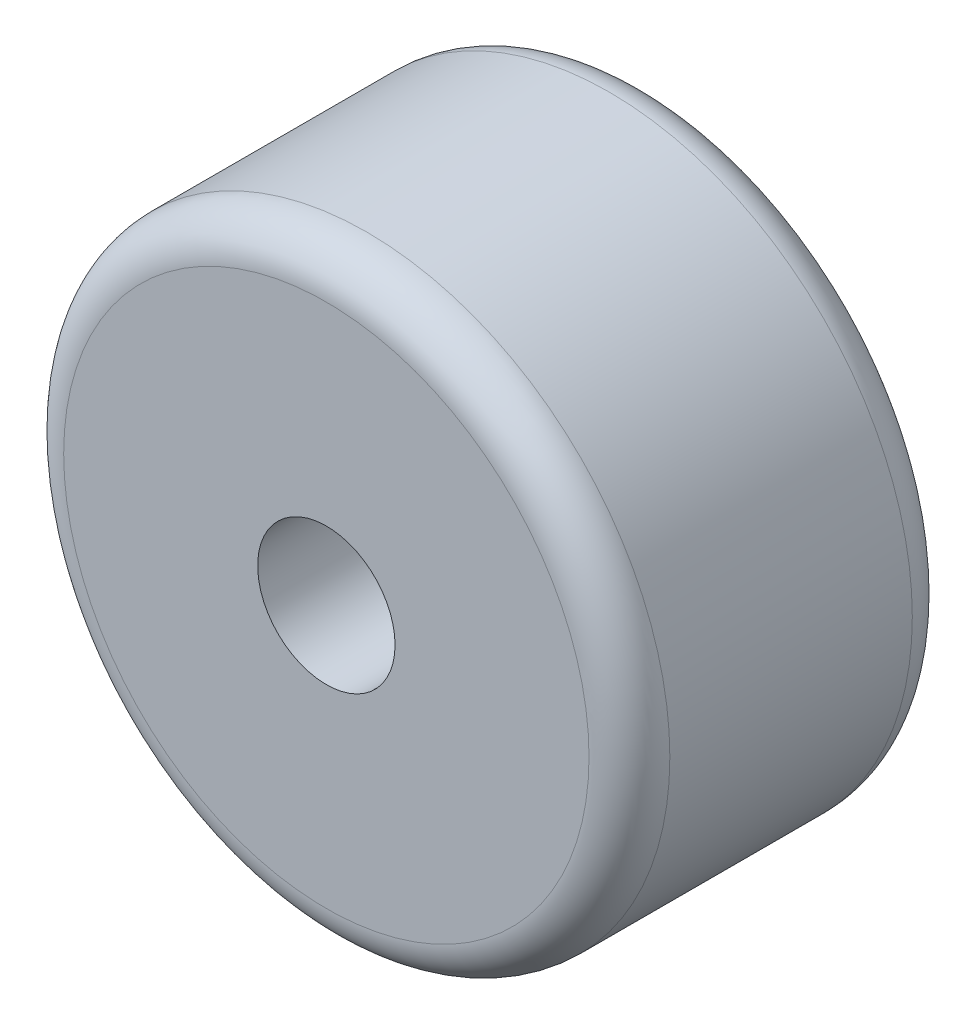
from build123d import *

# Parameters (mm, degrees)
SKETCH1_R           = 7.5
SKETCH1_R_2         = 1.7
BOSS_EXTRUDE1_DEPTH = 8
FILLET1_R           = 1


with BuildPart() as part:
    # Sketch1 → Boss-Extrude1 (new body)
    with BuildSketch(Plane.XY):
        Circle(SKETCH1_R)
        Circle(SKETCH1_R_2, mode=Mode.SUBTRACT)
    extrude(amount=BOSS_EXTRUDE1_DEPTH)

    # Fillet1
    fillet1_edges = [part.edges().sort_by_distance(p)[0] for p in [
        (-7.5, 0, 0),
        (-7.5, 0, 8),
    ]]
    fillet(fillet1_edges, radius=FILLET1_R)


solid = part.part
